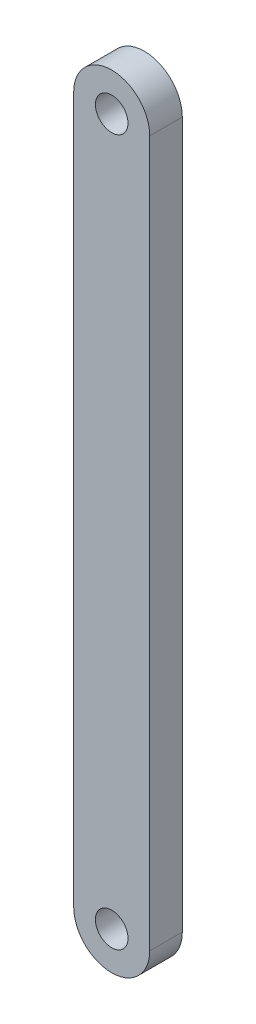
from build123d import *

# Parameters (mm, degrees)
SKETCH1_R           = 1.5
BOSS_EXTRUDE1_DEPTH = 1.5


with BuildPart() as part:
    # Sketch1 → Boss-Extrude1 (new, symmetric)
    with BuildSketch(Plane.XY):
        with BuildLine():
            Line((3.5, 32.5), (3.5, -32.5))
            ThreePointArc((3.5, -32.5), (0, -36), (-3.5, -32.5))
            Line((-3.5, -32.5), (-3.5, 32.5))
            ThreePointArc((-3.5, 32.5), (0, 36), (3.5, 32.5))
        make_face()
        with Locations((0, -32.5)):
            Circle(SKETCH1_R, mode=Mode.SUBTRACT)
        with Locations((0, 32.5)):
            Circle(SKETCH1_R, mode=Mode.SUBTRACT)
    extrude(amount=BOSS_EXTRUDE1_DEPTH, both=True)


solid = part.part
